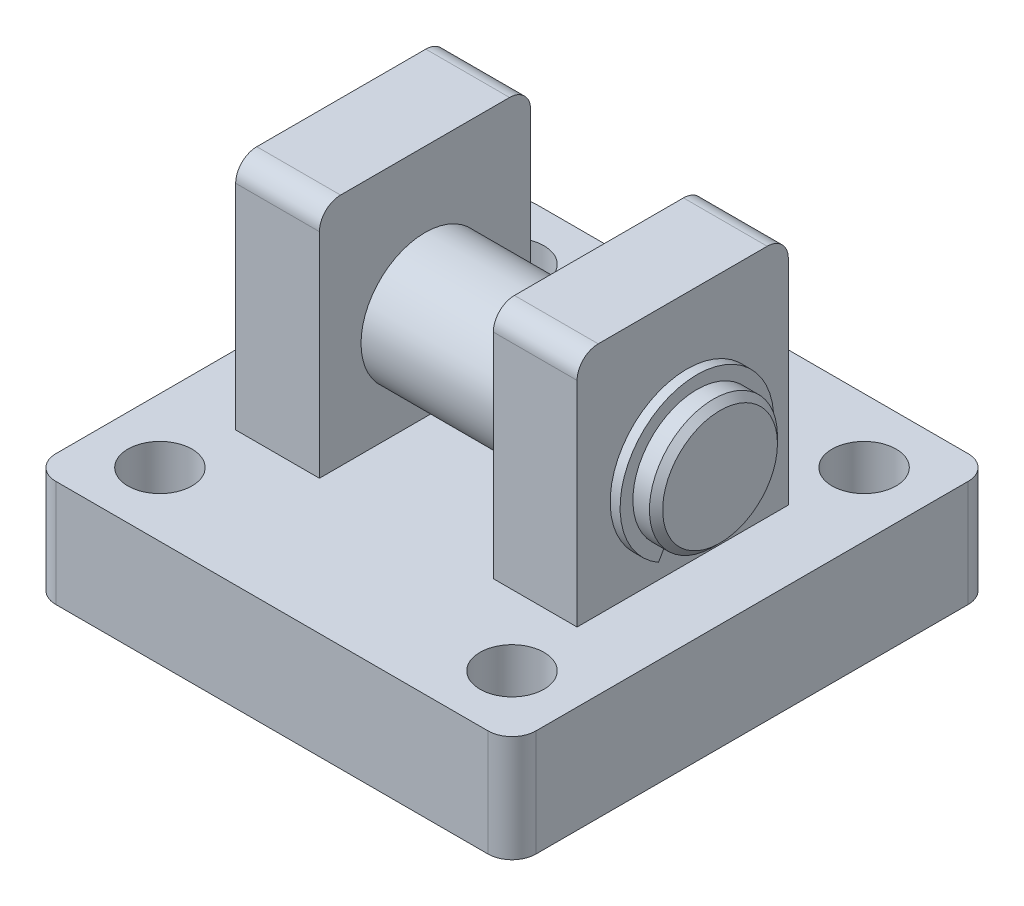
from build123d import *

# Parameters (mm, degrees)
SKETCH_3_W               = 45
SKETCH_3_H               = 45
EXTRUDE_1_DEPTH          = 10
EXTRUDE_START            = -38.5
SKETCH_4_W               = 19.8
SKETCH_4_H               = 22
EXTRUDE_2_DEPTH          = 32
SKETCH_5_W               = 16.3
SKETCH_5_H               = 19.8
CUT_EXTRUDE_1_DEPTH      = 22
SKETCH_6_R               = 6
EXTRUDE_3_DEPTH          = 19.5
CUT_EXTRUDE_START        = -3.1
SKETCH_7_R               = 6
SKETCH_7_R_2             = 5.4
CUT_EXTRUDE_3_DEPTH      = 0.93
SKETCH_8_R               = 3
CUT_EXTRUDE_4_DEPTH      = 39.684622268
MIRROR_4_COPY_1_SKETCH_R = 3
MIRROR_4_COPY_1_DEPTH    = 39.684622268
EXTRUDE_4_DEPTH          = 0.93
FILLET_1_R               = 2.25
FILLET_2_R               = 1.98
CHAMFER_1_SIZE           = 0.62


with BuildPart() as part:
    # 草图3 → 凸台-拉伸1 (new body)
    with BuildSketch(Plane(origin=(0, 0, 0), x_dir=(1, 0, 0), z_dir=(0, 1, 0))):
        Rectangle(SKETCH_3_W, SKETCH_3_H)
    extrude(amount=EXTRUDE_1_DEPTH)

    # 草图4 → 凸台-拉伸2 (add)
    with BuildSketch(Plane(origin=(22.5, 0, 0), x_dir=(0, 0, -1), z_dir=(1, 0, 0)).offset(EXTRUDE_START)):
        with Locations((0, 21)):
            Rectangle(SKETCH_4_W, SKETCH_4_H)
    extrude(amount=EXTRUDE_2_DEPTH)

    # 草图5 → 切除-拉伸1 (cut)
    with BuildSketch(Plane(origin=(0, 10, 0), x_dir=(-1, 0, 0), z_dir=(0, 1, 0))):
        Rectangle(SKETCH_5_W, SKETCH_5_H)
    extrude(amount=CUT_EXTRUDE_1_DEPTH, mode=Mode.SUBTRACT)

    # 草图6 → 凸台-拉伸3 (add)
    with BuildSketch(Plane(origin=(0, 0, 0), x_dir=(0, 0, -1), z_dir=(1, 0, 0))):
        with Locations(Location((0, 19, 0), (0, 0, 180))):
            Circle(SKETCH_6_R)
    extrude_3 = extrude(amount=EXTRUDE_3_DEPTH)

    # 镜向1: 凸台-拉伸3 across plane
    add(extrude_3.mirror(Plane(origin=(0, 0, 0), x_dir=(0, 0, 1), z_dir=(1, 0, 0))))

    # 草图7 → 切除-拉伸3 (cut)
    with BuildSketch(Plane(origin=(19.5, 0, 0), x_dir=(0, 0, -1), z_dir=(1, 0, 0)).offset(CUT_EXTRUDE_START)):
        with Locations(Location((0, 19, 0), (0, 0, 180))):
            Circle(SKETCH_7_R)
        with Locations((0, 19)):
            Circle(SKETCH_7_R_2, mode=Mode.SUBTRACT)
    cut_extrude_3 = extrude(amount=CUT_EXTRUDE_3_DEPTH, mode=Mode.SUBTRACT)

    # 镜向2: 切除-拉伸3 across plane
    add(cut_extrude_3.mirror(Plane(origin=(0, 0, 0), x_dir=(0, 0, 1), z_dir=(1, 0, 0))), mode=Mode.SUBTRACT)

    # 草图8 → 切除-拉伸4 (cut, through all)
    with BuildSketch(Plane(origin=(0, 10, 0), x_dir=(1, 0, 0), z_dir=(0, 1, 0))):
        with Locations(Location((-16.5, 16.5, 0), (0, 0, 270))):
            Circle(SKETCH_8_R)
    cut_extrude_4 = extrude(amount=-CUT_EXTRUDE_4_DEPTH, mode=Mode.SUBTRACT)

    # 镜向3: 切除-拉伸4 across plane
    add(cut_extrude_4.mirror(Plane(origin=(0, 0, 0), x_dir=(0, 0, 1), z_dir=(1, 0, 0))), mode=Mode.SUBTRACT)

    # 镜向4: 切除-拉伸4 across plane
    add(cut_extrude_4.mirror(Plane.XY), mode=Mode.SUBTRACT)

    # 镜向4 copy 1 sketch → 镜向4 copy 1 (cut, through all)
    with BuildSketch(Plane(origin=(0, 10, 0), x_dir=(-1, 0, 0), z_dir=(0, 1, 0))):
        with Locations(Location((-16.5, 16.5, 0), (0, 0, 270))):
            Circle(MIRROR_4_COPY_1_SKETCH_R)
    extrude(amount=-MIRROR_4_COPY_1_DEPTH, mode=Mode.SUBTRACT)

    # 草图9 → 凸台-拉伸4 (add)
    with BuildSketch(Plane(origin=(16.4, 0, 0), x_dir=(0, 0, -1), z_dir=(1, 0, 0))):
        with BuildLine():
            Line((0, 19), (-3.6, 12.764617093))
            ThreePointArc((-3.6, 12.764617093), (0, 26.2), (3.6, 12.764617093))
            Line((3.6, 12.764617093), (0, 19))
        make_face()
    extrude_4 = extrude(amount=EXTRUDE_4_DEPTH)

    # 镜向5: 凸台-拉伸4 across plane
    add(extrude_4.mirror(Plane(origin=(0, 0, 0), x_dir=(0, 0, 1), z_dir=(1, 0, 0))))

    # 圆角1
    fillet_1_edges = [part.edges().sort_by_distance(p)[0] for p in [
        (-22.5, 5, 22.5),
        (-22.5, 5, -22.5),
        (22.5, 5, -22.5),
        (22.5, 5, 22.5),
    ]]
    fillet(fillet_1_edges, radius=FILLET_1_R)

    # 圆角2
    fillet_2_edges = [part.edges().sort_by_distance(p)[0] for p in [
        (12.075, 32, -9.9),
        (12.075, 32, 9.9),
        (-12.075, 32, 9.9),
        (-12.075, 32, -9.9),
    ]]
    fillet(fillet_2_edges, radius=FILLET_2_R)

    # 倒角1
    chamfer_1_edges = [part.edges().sort_by_distance(p)[0] for p in [
        (19.5, 19, -6),
        (-19.5, 19, -6),
    ]]
    chamfer(chamfer_1_edges, length=CHAMFER_1_SIZE)


solid = part.part
